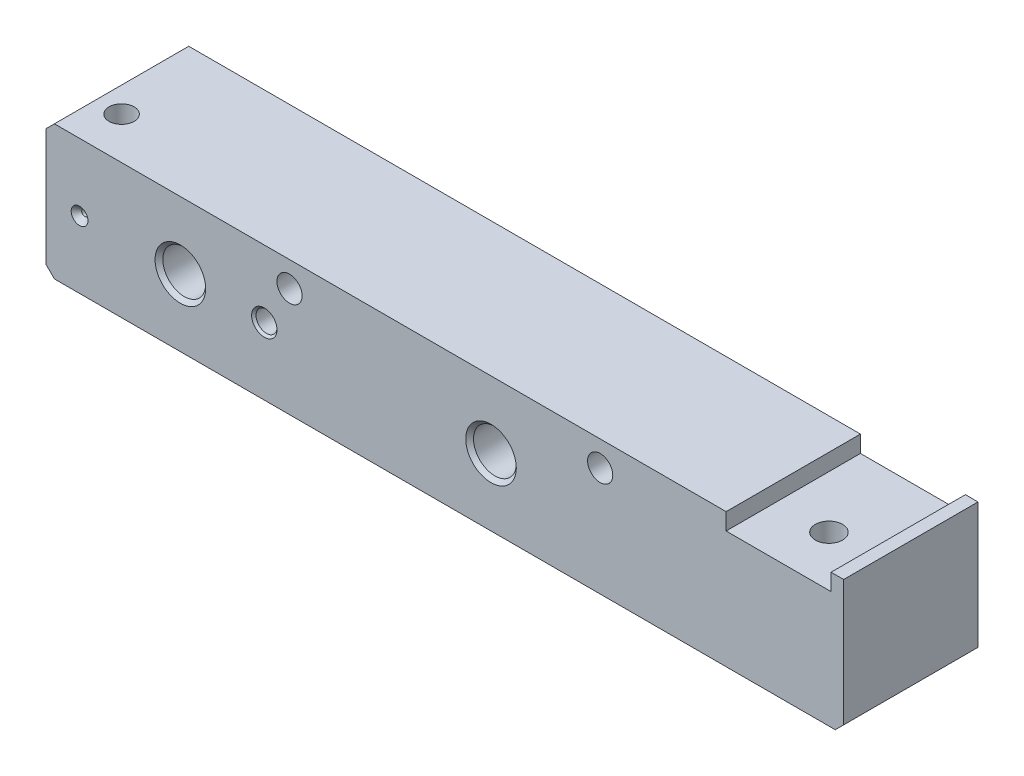
from build123d import *

# Parameters (mm, degrees)
BOSS_EXTRUDE1_DEPTH                                  = 16
M12_TAPPED_HOLE2_D                                   = 10.2
M12_TAPPED_HOLE2_DEPTH                               = 24
M12_TAPPED_HOLE2_CSINK_D                             = 12.05
M12_TAPPED_HOLE2_CSINK_ANGLE                         = 90
M12_TAPPED_HOLE2_TIP                                 = 3.064389157
M4_TAPPED_HOLE1_D                                    = 3.3
M4_TAPPED_HOLE1_DEPTH                                = 11.5
M4_TAPPED_HOLE1_CSINK_D                              = 4.05
M4_TAPPED_HOLE1_CSINK_ANGLE                          = 90
M4_TAPPED_HOLE1_TIP                                  = 0.991420021
SKETCH15_R                                           = 3
CUT_EXTRUDE1_DEPTH                                   = 102.513545894
CSK_FOR_M4_COUNTERSUNK_FLAT_HEAD_SCREW1_D            = 1.5
CSK_FOR_M4_COUNTERSUNK_FLAT_HEAD_SCREW1_DEPTH        = 10
CSK_FOR_M4_COUNTERSUNK_FLAT_HEAD_SCREW1_CSINK_D      = 4
CSK_FOR_M4_COUNTERSUNK_FLAT_HEAD_SCREW1_CSINK_ANGLE  = 90
CSK_FOR_M4_COUNTERSUNK_FLAT_HEAD_SCREW1_TIP          = 0.450645464
M6_TAPPED_HOLE1_D                                    = 5
M6_TAPPED_HOLE1_DEPTH                                = 16
M6_TAPPED_HOLE1_CSINK_D                              = 6.05
M6_TAPPED_HOLE1_CSINK_ANGLE                          = 90
M6_TAPPED_HOLE1_TIP                                  = 1.502151548
SKETCH22_R                                           = 3
CUT_EXTRUDE2_DEPTH                                   = 102.51354591
CSK_FOR_M10_COUNTERSUNK_FLAT_HEAD_SCREW2_D           = 6.5
CSK_FOR_M10_COUNTERSUNK_FLAT_HEAD_SCREW2_DEPTH       = 32
CSK_FOR_M10_COUNTERSUNK_FLAT_HEAD_SCREW2_CSINK_D     = 13
CSK_FOR_M10_COUNTERSUNK_FLAT_HEAD_SCREW2_CSINK_ANGLE = 90
CSK_FOR_M10_COUNTERSUNK_FLAT_HEAD_SCREW2_TIP         = 1.952797012


with BuildPart() as part:
    # Sketch1 → Boss-Extrude1 (new, symmetric)
    with BuildSketch(Plane.XY):
        Polygon((67, 12), (92, 12), (92, 16), (95, 16), (95, -14), (93, -16), (-93, -16), (-95, -14), (-95, 14), (-93, 16), (67, 16), align=None)
    extrude(amount=BOSS_EXTRUDE1_DEPTH, both=True)

    # M12 Tapped Hole2
    with Locations(Plane.XY.offset(16)):
        with Locations((-63, 0), (11, 0)):
            CounterSinkHole(M12_TAPPED_HOLE2_D / 2, M12_TAPPED_HOLE2_CSINK_D / 2, depth=M12_TAPPED_HOLE2_DEPTH, counter_sink_angle=M12_TAPPED_HOLE2_CSINK_ANGLE)
            with Locations((0, 0, -(M12_TAPPED_HOLE2_DEPTH + M12_TAPPED_HOLE2_TIP / 2))):  # 118° drill point
                Cone(0, M12_TAPPED_HOLE2_D / 2, M12_TAPPED_HOLE2_TIP, mode=Mode.SUBTRACT)

    # M4 Tapped Hole1
    with Locations(Plane(origin=(0, -16, 0), x_dir=(-1, 0, 0), z_dir=(0, -1, 0))):
        with Locations((-11, -4), (63, -4)):
            CounterSinkHole(M4_TAPPED_HOLE1_D / 2, M4_TAPPED_HOLE1_CSINK_D / 2, depth=M4_TAPPED_HOLE1_DEPTH, counter_sink_angle=M4_TAPPED_HOLE1_CSINK_ANGLE)
            with Locations((0, 0, -(M4_TAPPED_HOLE1_DEPTH + M4_TAPPED_HOLE1_TIP / 2))):  # 118° drill point
                Cone(0, M4_TAPPED_HOLE1_D / 2, M4_TAPPED_HOLE1_TIP, mode=Mode.SUBTRACT)

    # Sketch15 → Cut-Extrude1 (cut, through all)
    with BuildSketch(Plane.XZ.offset(16)):
        with Locations(Location((-87, 6, 0), (0, 0, 270))):
            Circle(SKETCH15_R)
    extrude(amount=-CUT_EXTRUDE1_DEPTH, mode=Mode.SUBTRACT)

    # CSK for M4 Countersunk Flat Head Screw1
    with Locations(Plane.XY.offset(16)):
        with Locations((-87, 0)):
            CounterSinkHole(CSK_FOR_M4_COUNTERSUNK_FLAT_HEAD_SCREW1_D / 2, CSK_FOR_M4_COUNTERSUNK_FLAT_HEAD_SCREW1_CSINK_D / 2, depth=CSK_FOR_M4_COUNTERSUNK_FLAT_HEAD_SCREW1_DEPTH, counter_sink_angle=CSK_FOR_M4_COUNTERSUNK_FLAT_HEAD_SCREW1_CSINK_ANGLE)
            with Locations((0, 0, -(CSK_FOR_M4_COUNTERSUNK_FLAT_HEAD_SCREW1_DEPTH + CSK_FOR_M4_COUNTERSUNK_FLAT_HEAD_SCREW1_TIP / 2))):  # 118° drill point
                Cone(0, CSK_FOR_M4_COUNTERSUNK_FLAT_HEAD_SCREW1_D / 2, CSK_FOR_M4_COUNTERSUNK_FLAT_HEAD_SCREW1_TIP, mode=Mode.SUBTRACT)

    # M6 Tapped Hole1
    with Locations(Plane.XY.offset(16)):
        with Locations((-43, 0)):
            CounterSinkHole(M6_TAPPED_HOLE1_D / 2, M6_TAPPED_HOLE1_CSINK_D / 2, depth=M6_TAPPED_HOLE1_DEPTH, counter_sink_angle=M6_TAPPED_HOLE1_CSINK_ANGLE)
            with Locations((0, 0, -(M6_TAPPED_HOLE1_DEPTH + M6_TAPPED_HOLE1_TIP / 2))):  # 118° drill point
                Cone(0, M6_TAPPED_HOLE1_D / 2, M6_TAPPED_HOLE1_TIP, mode=Mode.SUBTRACT)

    # Sketch22 → Cut-Extrude2 (cut, through all)
    with BuildSketch(Plane.XY.offset(16)):
        with Locations((-37, 10)):
            Circle(SKETCH22_R)
        with Locations((37, 10)):
            Circle(SKETCH22_R)
    extrude(amount=-CUT_EXTRUDE2_DEPTH, mode=Mode.SUBTRACT)

    # CSK for M10 Countersunk Flat Head Screw2
    with Locations(Plane(origin=(0, -16, 0), x_dir=(-1, 0, 0), z_dir=(0, -1, 0))):
        with Locations((-79.5, -4)):
            CounterSinkHole(CSK_FOR_M10_COUNTERSUNK_FLAT_HEAD_SCREW2_D / 2, CSK_FOR_M10_COUNTERSUNK_FLAT_HEAD_SCREW2_CSINK_D / 2, depth=CSK_FOR_M10_COUNTERSUNK_FLAT_HEAD_SCREW2_DEPTH, counter_sink_angle=CSK_FOR_M10_COUNTERSUNK_FLAT_HEAD_SCREW2_CSINK_ANGLE)
            with Locations((0, 0, -(CSK_FOR_M10_COUNTERSUNK_FLAT_HEAD_SCREW2_DEPTH + CSK_FOR_M10_COUNTERSUNK_FLAT_HEAD_SCREW2_TIP / 2))):  # 118° drill point
                Cone(0, CSK_FOR_M10_COUNTERSUNK_FLAT_HEAD_SCREW2_D / 2, CSK_FOR_M10_COUNTERSUNK_FLAT_HEAD_SCREW2_TIP, mode=Mode.SUBTRACT)


solid = part.part
